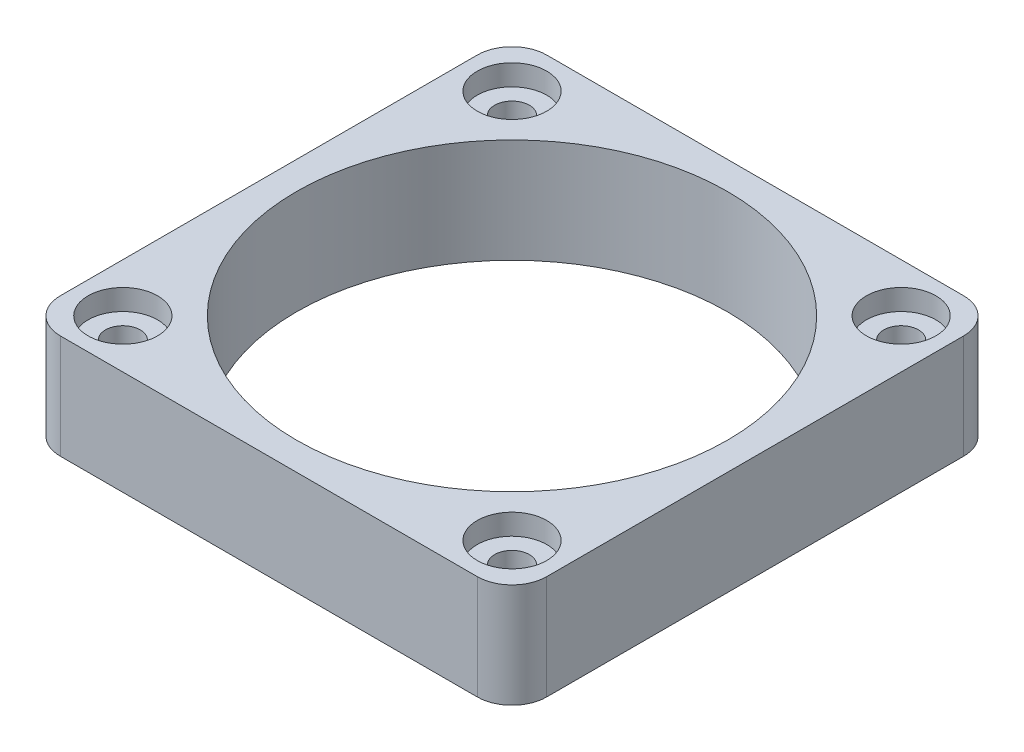
from build123d import *

# Parameters (mm, degrees)
SKETCH1_W           = 70
SKETCH1_H           = 70
SKETCH1_R           = 31
BOSS_EXTRUDE1_DEPTH = 15
SKETCH2_R           = 2.5
CUT_EXTRUDE1_DEPTH  = 52.720402164
FILLET1_R           = 5
SKETCH3_R           = 5
CUT_EXTRUDE2_DEPTH  = 3


with BuildPart() as part:
    # Sketch1 → Boss-Extrude1 (new body)
    with BuildSketch(Plane(origin=(0, 0, 0), x_dir=(1, 0, 0), z_dir=(0, 1, 0))):
        Rectangle(SKETCH1_W, SKETCH1_H)
        with Locations(Location((0, 0, 0), (0, 0, 270))):
            Circle(SKETCH1_R, mode=Mode.SUBTRACT)
    extrude(amount=BOSS_EXTRUDE1_DEPTH)

    # Sketch2 → Cut-Extrude1 (cut, through all)
    with BuildSketch(Plane(origin=(0, 15, 0), x_dir=(1, 0, 0), z_dir=(0, 1, 0))):
        with Locations(Location((-28, 28, 0), (0, 0, 270))):
            Circle(SKETCH2_R)
        with Locations(Location((28, 28, 0), (0, 0, 90))):
            Circle(SKETCH2_R)
        with Locations(Location((28, -28, 0), (0, 0, 270))):
            Circle(SKETCH2_R)
        with Locations(Location((-28, -28, 0), (0, 0, 90))):
            Circle(SKETCH2_R)
    extrude(amount=-CUT_EXTRUDE1_DEPTH, mode=Mode.SUBTRACT)

    # Fillet1
    fillet1_edges = [part.edges().sort_by_distance(p)[0] for p in [
        (35, 7.5, 35),
        (-35, 7.5, 35),
        (-35, 7.5, -35),
        (35, 7.5, -35),
    ]]
    fillet(fillet1_edges, radius=FILLET1_R)

    # Sketch3 → Cut-Extrude2 (cut)
    with BuildSketch(Plane(origin=(0, 15, 0), x_dir=(1, 0, 0), z_dir=(0, 1, 0))):
        with Locations(Location((-28, 28, 0), (0, 0, 270))):
            Circle(SKETCH3_R)
        with Locations(Location((-28, -28, 0), (0, 0, 90))):
            Circle(SKETCH3_R)
        with Locations(Location((28, 28, 0), (0, 0, 90))):
            Circle(SKETCH3_R)
        with Locations(Location((28, -28, 0), (0, 0, 270))):
            Circle(SKETCH3_R)
    extrude(amount=-CUT_EXTRUDE2_DEPTH, mode=Mode.SUBTRACT)


solid = part.part
